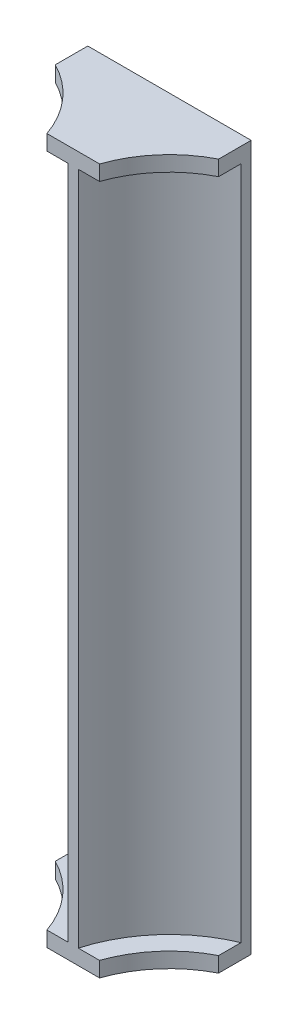
from build123d import *

# Parameters (mm, degrees)
EXTRUDE_1_DEPTH = 66.4
EXTRUDE_2_DEPTH = 1.5
EXTRUDE_START   = 1.5
EXTRUDE_3_DEPTH = 1.5


with BuildPart() as part:
    # 草图1 → 凸台-拉伸1 (new body)
    with BuildSketch(Plane(origin=(0, 0, 0), x_dir=(1, 0, 0), z_dir=(0, 1, 0))):
        with BuildLine():
            Line((12.55, 3.577708764), (13.55, 3.577708764))
            ThreePointArc((13.55, 3.577708764), (16.351500522, 8.675785724), (21.09000998, 12.05))
            Line((21.09000998, 12.05), (21.09000998, 13.05))
            Line((21.09000998, 13.05), (5.00999002, 13.05))
            Line((5.00999002, 13.05), (5.00999002, 12.05))
            ThreePointArc((5.00999002, 12.05), (9.748499478, 8.675785724), (12.55, 3.577708764))
        make_face()
    extrude(amount=EXTRUDE_1_DEPTH)

    # 草图2 → 凸台-拉伸2 (add)
    with BuildSketch(Plane(origin=(0, 66.4, 0), x_dir=(1, 0, 0), z_dir=(0, 1, 0))):
        with BuildLine():
            Line((5.00999002, 13.05), (5.00999002, 9.848984719))
            ThreePointArc((5.00999002, 9.848984719), (8.343981739, 7.244340463), (10.454783594, 3.577708764))
            Line((10.454783594, 3.577708764), (15.645216406, 3.577708764))
            ThreePointArc((15.645216406, 3.577708764), (17.756018261, 7.244340463), (21.09000998, 9.848984719))
            Line((21.09000998, 9.848984719), (21.09000998, 13.05))
            Line((21.09000998, 13.05), (5.00999002, 13.05))
        make_face()
    extrude(amount=EXTRUDE_2_DEPTH)

    # 草图3 → 凸台-拉伸3 (add)
    with BuildSketch(Plane.XZ.offset(EXTRUDE_START)):
        with BuildLine():
            Line((12.55, -3.577708764), (10.454783594, -3.577708764))
            ThreePointArc((10.454783594, -3.577708764), (8.343981739, -7.244340463), (5.00999002, -9.848984719))
            Line((5.00999002, -9.848984719), (5.00999002, -12.05))
            ThreePointArc((5.00999002, -12.05), (9.748499478, -8.675785724), (12.55, -3.577708764))
        make_face()
        with BuildLine():
            Line((13.55, -3.577708764), (12.55, -3.577708764))
            ThreePointArc((12.55, -3.577708764), (9.748499478, -8.675785724), (5.00999002, -12.05))
            Line((5.00999002, -12.05), (5.00999002, -13.05))
            Line((5.00999002, -13.05), (21.09000998, -13.05))
            Line((21.09000998, -13.05), (21.09000998, -12.05))
            ThreePointArc((21.09000998, -12.05), (16.351500522, -8.675785724), (13.55, -3.577708764))
        make_face()
        with BuildLine():
            Line((15.645216406, -3.577708764), (13.55, -3.577708764))
            ThreePointArc((13.55, -3.577708764), (16.351500522, -8.675785724), (21.09000998, -12.05))
            Line((21.09000998, -12.05), (21.09000998, -9.848984719))
            ThreePointArc((21.09000998, -9.848984719), (17.756018261, -7.244340463), (15.645216406, -3.577708764))
        make_face()
    extrude(amount=-EXTRUDE_3_DEPTH)


solid = part.part
